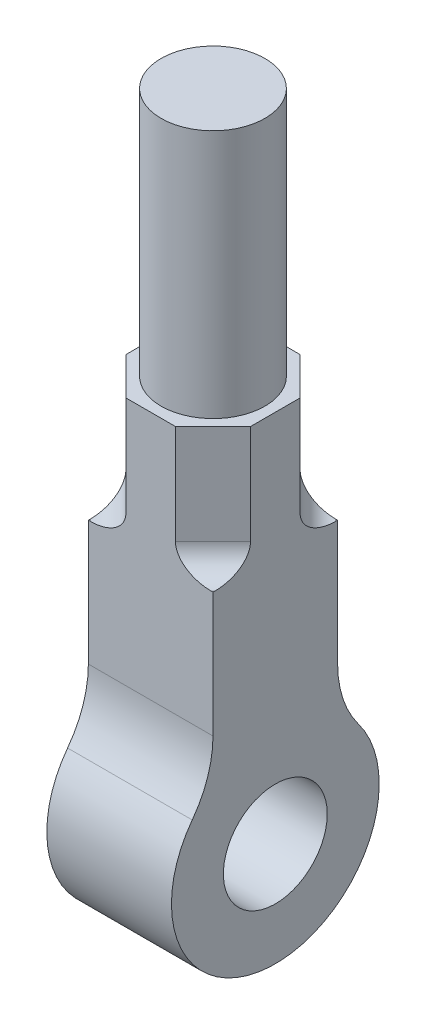
from build123d import *

# Parameters (mm, degrees)
SKETCH1_R           = 25
BOSS_EXTRUDE1_DEPTH = 60
CUT_EXTRUDE3_DEPTH  = 60
SKETCH2_4_R         = 25
BOSS_EXTRUDE2_DEPTH = 120
FILLET1_R           = 12


with BuildPart() as part:
    # Sketch1 → Boss-Extrude1 (new body)
    with BuildSketch(Plane.YZ):
        with BuildLine():
            Line((60, 30), (180, 30))
            Line((180, 30), (180, -30))
            Line((180, -30), (60, -30))
            ThreePointArc((60, -30), (44.188611699, -32.565835097), (30, -40))
            ThreePointArc((30, -40), (-50, 0), (30, 40))
            ThreePointArc((30, 40), (44.188611699, 32.565835097), (60, 30))
        make_face()
        Circle(SKETCH1_R, mode=Mode.SUBTRACT)
    extrude(amount=BOSS_EXTRUDE1_DEPTH)

    # Sketch2 → Cut-Extrude3 (cut)
    with BuildSketch(Plane(origin=(0, 180, 0), x_dir=(-1, 0, 0), z_dir=(0, 1, 0))):
        Polygon((0, 30), (-18.06, 30), (0, 11.94), align=None)
        Polygon((-60, 11.94), (-41.94, 30), (-60, 30), align=None)
        Polygon((0, -30), (0, -11.94), (-18.06, -30), align=None)
        Polygon((-41.94, -30), (-60, -11.94), (-60, -30), align=None)
    extrude(amount=-CUT_EXTRUDE3_DEPTH, mode=Mode.SUBTRACT)

    # Sketch2<4> → Boss-Extrude2 (add)
    with BuildSketch(Plane(origin=(0, 180, 0), x_dir=(-1, 0, 0), z_dir=(0, 1, 0))):
        with Locations((-30, 0)):
            Circle(SKETCH2_4_R)
    extrude(amount=BOSS_EXTRUDE2_DEPTH)

    # Fillet1
    fillet1_edges = [part.edges().sort_by_distance(p)[0] for p in [
        (9.03, 120, -20.97),
        (9.03, 120, 20.97),
        (50.97, 120, -20.97),
        (50.97, 120, 20.97),
    ]]
    fillet(fillet1_edges, radius=FILLET1_R)


solid = part.part
